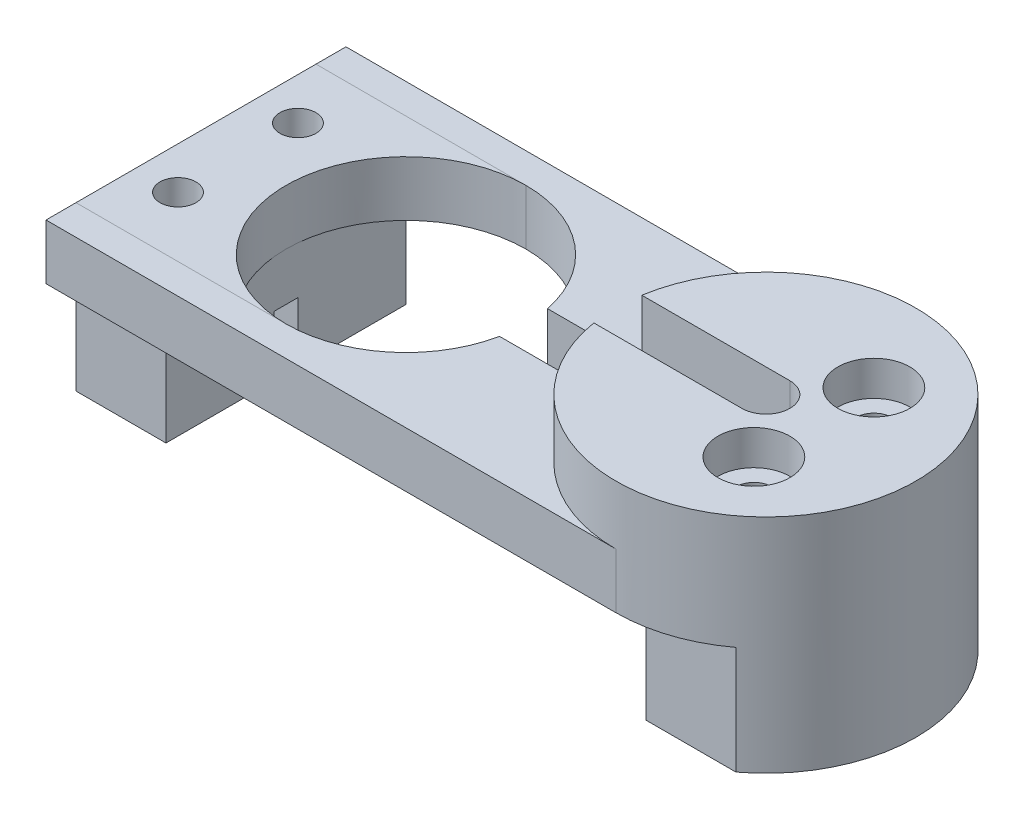
from build123d import *

# Parameters (mm, degrees)
SKETCH_1_W           = 40
SKETCH_1_H           = 20
EXTRUDE_1_DEPTH      = 4.6
SKETCH_2_R           = 6.5
CUT_EXTRUDE_1_DEPTH  = 2
SKETCH_4_R           = 5.5
CUT_EXTRUDE_5_DEPTH  = 2.6
SKETCH_5_R           = 12.5
EXTRUDE_2_DEPTH      = 9.5
SKETCH_6_R           = 4.5
CUT_EXTRUDE_6_DEPTH  = 4
SKETCH_7_R           = 2
CUT_EXTRUDE_7_DEPTH  = 36.252659474
EXTRUDE_4_DEPTH      = 9
EXTRUDE_4_DEPTH_BACK = 4.6
SKETCH_8_W           = 7.5
SKETCH_8_H           = 20
SKETCH_9_W           = 5
SKETCH_9_H           = 2
CUT_EXTRUDE_8_DEPTH  = 5
SKETCH_10_R          = 1.5
CUT_EXTRUDE_9_DEPTH  = 40.430318284
SKETCH_13_R          = 3
CUT_EXTRUDE_10_DEPTH = 2.9
SKETCH_14_W          = 24.876524617
SKETCH_14_H          = 4
CUT_EXTRUDE_11_DEPTH = 9.5
SKETCH_15_R          = 10
CUT_EXTRUDE_14_DEPTH = 5
EXTRUDE_5_DEPTH      = 4.6


with BuildPart() as part:
    # 草图1 → 凸台-拉伸1 (new body)
    with BuildSketch(Plane(origin=(0, 0, 0), x_dir=(1, 0, 0), z_dir=(0, 1, 0))):
        Rectangle(SKETCH_1_W, SKETCH_1_H)
    extrude(amount=EXTRUDE_1_DEPTH)

    # 草图2 → 切除-拉伸1 (cut)
    with BuildSketch(Plane.XZ):
        with Locations(Location((-10, 0, 0), (0, 0, 270))):
            Circle(SKETCH_2_R)
    extrude(amount=-CUT_EXTRUDE_1_DEPTH, mode=Mode.SUBTRACT)

    # 草图4 → 切除-拉伸5 (cut)
    with BuildSketch(Plane.XZ.offset(-2)):
        with Locations(Location((-10, 0, 0), (0, 0, 270))):
            Circle(SKETCH_4_R)
    extrude(amount=-CUT_EXTRUDE_5_DEPTH, mode=Mode.SUBTRACT)

    # 草图5 → 凸台-拉伸2 (add)
    with BuildSketch(Plane.XZ):
        with Locations(Location((20, 0, 0), (0, 0, 270))):
            Circle(SKETCH_5_R)
    extrude(amount=-EXTRUDE_2_DEPTH)

    # 草图6 → 切除-拉伸6 (cut)
    with BuildSketch(Plane.XZ):
        with Locations(Location((20, 0, 0), (0, 0, 270))):
            Circle(SKETCH_6_R)
    extrude(amount=-CUT_EXTRUDE_6_DEPTH, mode=Mode.SUBTRACT)

    # 草图7 → 切除-拉伸7 (cut, through all)
    with BuildSketch(Plane.XZ.offset(-4)):
        with Locations(Location((20, 0, 0), (0, 0, 270))):
            Circle(SKETCH_7_R)
    extrude(amount=-CUT_EXTRUDE_7_DEPTH, mode=Mode.SUBTRACT)

    # 草图8 → 凸台-拉伸4 (add, two sides: drawn at the far end of the back side and taken through both)
    with BuildSketch(Plane.XZ.offset(-EXTRUDE_4_DEPTH_BACK)):
        with Locations((-23.75, 0)):
            Rectangle(SKETCH_8_W, SKETCH_8_H)
        with BuildLine():
            Line((20, -4.5), (20, -10))
            Line((20, -10), (27.5, -10))
            ThreePointArc((27.5, -10), (32.5, 0), (27.5, 10))
            Line((27.5, 10), (20, 10))
            Line((20, 10), (20, 4.5))
            ThreePointArc((20, 4.5), (24.5, 0), (20, -4.5))
        make_face()
    extrude(amount=EXTRUDE_4_DEPTH + EXTRUDE_4_DEPTH_BACK)

    # 草图9 → 切除-拉伸8 (cut)
    with BuildSketch(Plane.XZ.offset(9)):
        with Locations((-22.5, 0)):
            Rectangle(SKETCH_9_W, SKETCH_9_H)
        with Locations((22.5, 0)):
            Rectangle(SKETCH_9_W, SKETCH_9_H)
    extrude(amount=-CUT_EXTRUDE_8_DEPTH, mode=Mode.SUBTRACT)

    # 草图10 → 切除-拉伸9 (cut, through all)
    with BuildSketch(Plane.XZ.offset(9)):
        with Locations(Location((-24, 5, 0), (0, 0, 270))):
            Circle(SKETCH_10_R)
        with Locations(Location((-24, -5, 0), (0, 0, 270))):
            Circle(SKETCH_10_R)
        with Locations(Location((24, -5, 0), (0, 0, 270))):
            Circle(SKETCH_10_R)
        with Locations(Location((24, 5, 0), (0, 0, 90))):
            Circle(SKETCH_10_R)
    extrude(amount=-CUT_EXTRUDE_9_DEPTH, mode=Mode.SUBTRACT)

    # 草图13 → 切除-拉伸10 (cut)
    with BuildSketch(Plane(origin=(0, 9.5, 0), x_dir=(1, 0, 0), z_dir=(0, 1, 0))):
        with Locations(Location((24, -5, 0), (0, 0, 270))):
            Circle(SKETCH_13_R)
        with Locations(Location((24, 5, 0), (0, 0, 270))):
            Circle(SKETCH_13_R)
    extrude(amount=-CUT_EXTRUDE_10_DEPTH, mode=Mode.SUBTRACT)

    # 草图14 → 切除-拉伸11 (cut)
    with BuildSketch(Plane(origin=(0, 9.5, 0), x_dir=(1, 0, 0), z_dir=(0, 1, 0))):
        with Locations((7.561737691, 0)):
            Rectangle(SKETCH_14_W, SKETCH_14_H)
    extrude(amount=-CUT_EXTRUDE_11_DEPTH, mode=Mode.SUBTRACT)

    # 草图15 → 切除-拉伸14 (cut)
    with BuildSketch(Plane(origin=(0, 4.6, 0), x_dir=(1, 0, 0), z_dir=(0, 1, 0))):
        with Locations((-10, 0)):
            Circle(SKETCH_15_R)
    extrude(amount=-CUT_EXTRUDE_14_DEPTH, mode=Mode.SUBTRACT)


with BuildPart() as cut_extrude_14_piece_1:
    # of the separate pieces the step leaves, piece 1, a body of its own (cut_extrude_14_pieces)
    add(part.part.solids().sort_by_distance((12.5, 0, -10))[0])

    # 草图16 → 凸台-拉伸5 (add)
    with BuildSketch(Plane(origin=(0, 4.6, 0), x_dir=(1, 0, 0), z_dir=(0, 1, 0))):
        with BuildLine():
            Line((20, 12.5), (-27.5, 12.5))
            Line((-27.5, 12.5), (-27.5, 10))
            Line((-27.5, 10), (12.5, 10))
            ThreePointArc((12.5, 10), (16.047152925, 11.858541226), (20, 12.5))
        make_face()
        with BuildLine():
            Line((20, -12.5), (-27.5, -12.5))
            Line((-27.5, -12.5), (-27.5, -10))
            Line((-27.5, -10), (12.5, -10))
            ThreePointArc((12.5, -10), (16.047152925, -11.858541226), (20, -12.5))
        make_face()
    extrude(amount=-EXTRUDE_5_DEPTH)


with BuildPart() as cut_extrude_14_piece_2:
    # of the separate pieces the step leaves, piece 2, a body of its own (cut_extrude_14_pieces)
    add(part.part.solids().sort_by_distance((-20, 0, -10))[0])


solid = Compound([cut_extrude_14_piece_1.part, cut_extrude_14_piece_2.part])
